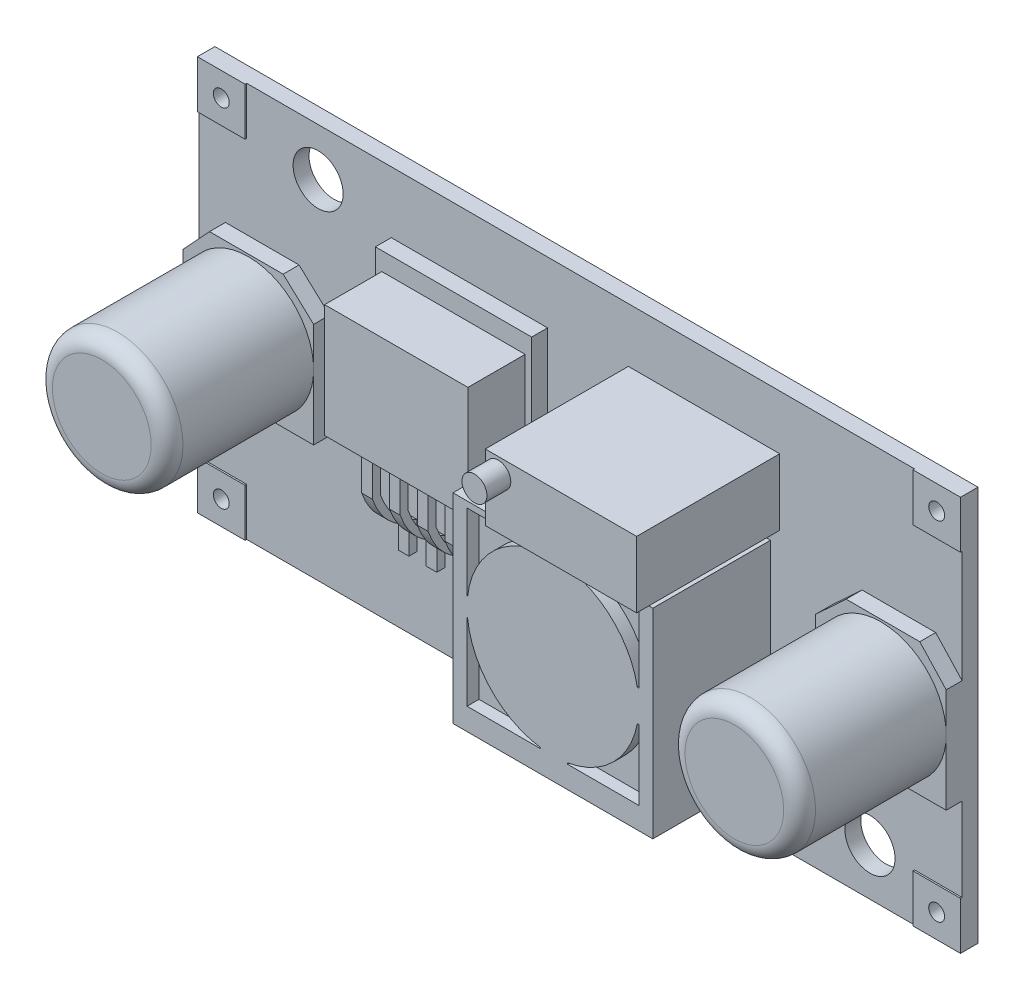
from build123d import *

# Parameters (mm, degrees)
SKETCH1_W           = 48
SKETCH1_H           = 24.85
SKETCH1_R           = 1.575
BOSS_EXTRUDE1_DEPTH = 1
SKETCH2_W           = 3
SKETCH2_H           = 3
BOSS_EXTRUDE2_DEPTH = 0.1
SKETCH3_R           = 0.5
CUT_EXTRUDE1_DEPTH  = 5
BOSS_EXTRUDE3_DEPTH = 1
SKETCH5_R           = 4.105
BOSS_EXTRUDE4_DEPTH = 9.22
FILLET1_R           = 1
FILLET2_R           = 1
SKETCH6_W           = 9.83
SKETCH6_H           = 8.75
BOSS_EXTRUDE5_DEPTH = 4.6
SKETCH7_W           = 9.83
SKETCH7_H           = 8.75
SKETCH7_W_2         = 9.014866003
SKETCH7_H_2         = 7.13033049
CUT_EXTRUDE2_DEPTH  = 3.6
SKETCH8_W           = 0.671327252
SKETCH8_H           = 3.75
BOSS_EXTRUDE6_DEPTH = 8
CUT_EXTRUDE3_DEPTH  = 9
SKETCH10_W          = 12.57
SKETCH10_H          = 12.57
BOSS_EXTRUDE7_DEPTH = 7.4
CUT_EXTRUDE7_DEPTH  = 0.75
SKETCH13_W          = 9.52
SKETCH13_H          = 4.17
BOSS_EXTRUDE8_DEPTH = 9
SKETCH14_R          = 0.785768403
BOSS_EXTRUDE9_DEPTH = 1.5


with BuildPart() as part:
    # Sketch1 → Boss-Extrude1 (new body)
    with BuildSketch(Plane.XY):
        Rectangle(SKETCH1_W, SKETCH1_H)
        with Locations((-16.506834237, 9.425)):
            Circle(SKETCH1_R, mode=Mode.SUBTRACT)
        with Locations((18.205231388, -9.425)):
            Circle(SKETCH1_R, mode=Mode.SUBTRACT)
    extrude(amount=BOSS_EXTRUDE1_DEPTH)

    # Sketch2 → Boss-Extrude2 (add)
    with BuildSketch(Plane.XY.offset(1)):
        with Locations((-22.5, 10.925)):
            Rectangle(SKETCH2_W, SKETCH2_H)
        with Locations((-22.5, -10.925)):
            Rectangle(SKETCH2_W, SKETCH2_H)
        with Locations((22.5, -10.925)):
            Rectangle(SKETCH2_W, SKETCH2_H)
        with Locations((22.5, 10.925)):
            Rectangle(SKETCH2_W, SKETCH2_H)
    extrude(amount=BOSS_EXTRUDE2_DEPTH)

    # Sketch3 → Cut-Extrude1 (cut)
    with BuildSketch(Plane.XY.offset(1.1)):
        with Locations((-22.5, 10.925)):
            Circle(SKETCH3_R)
        with Locations((-22.5, -10.925)):
            Circle(SKETCH3_R)
        with Locations((22.5, -10.925)):
            Circle(SKETCH3_R)
        with Locations((22.5, 10.925)):
            Circle(SKETCH3_R)
    extrude(amount=-CUT_EXTRUDE1_DEPTH, mode=Mode.SUBTRACT)

    # Sketch4 → Boss-Extrude3 (add)
    with BuildSketch(Plane.XY.offset(1)):
        Polygon((-17.706386609, 4.175), (-15.79, 2.397984661), (-15.79, -4.175), (-24, -4.175), (-24, 2.383236744), (-22.338544647, 4.175), align=None)
        Polygon((24, -4.175), (24, 2.383236744), (22.338544647, 4.175), (17.706386609, 4.175), (15.79, 2.397984661), (15.79, -4.175), align=None)
    extrude(amount=BOSS_EXTRUDE3_DEPTH)

    # Sketch5 → Boss-Extrude4 (add)
    with BuildSketch(Plane.XY.offset(2)):
        with Locations((-19.895, -0.07)):
            Circle(SKETCH5_R)
        with Locations(Location((19.895, -0.07, 0), (0, 0, 180))):
            Circle(SKETCH5_R)
    extrude(amount=BOSS_EXTRUDE4_DEPTH)

    # Fillet1
    fillet1_edges = [part.edges().sort_by_distance(p)[0] for p in [
        (-24, -0.07, 11.22),
    ]]
    fillet(fillet1_edges, radius=FILLET1_R)

    # Fillet2
    fillet2_edges = [part.edges().sort_by_distance(p)[0] for p in [
        (24, -0.07, 11.22),
    ]]
    fillet(fillet2_edges, radius=FILLET2_R)

    # Sketch6 → Boss-Extrude5 (add)
    with BuildSketch(Plane.XY.offset(1)):
        with Locations((-6.991368833, 4.188689514)):
            Rectangle(SKETCH6_W, SKETCH6_H)
    extrude(amount=BOSS_EXTRUDE5_DEPTH)

    # Sketch7 → Cut-Extrude2 (cut)
    with BuildSketch(Plane.XY.offset(5.6)):
        with Locations((-6.991368833, 4.188689514)):
            Rectangle(SKETCH7_W, SKETCH7_H)
        with Locations((-6.991368834, 3.853025888)):
            Rectangle(SKETCH7_W_2, SKETCH7_H_2, mode=Mode.SUBTRACT)
    extrude(amount=-CUT_EXTRUDE2_DEPTH, mode=Mode.SUBTRACT)

    # Sketch8 → Boss-Extrude6 (add)
    with BuildSketch(Plane(origin=(0, 0.287860643, 0), x_dir=(-1, 0, 0), z_dir=(0, -1, 0))):
        with Locations((8.85699558, -2.895840935)):
            Rectangle(SKETCH8_W, SKETCH8_H)
        with Locations((10.60699558, -2.895840935)):
            Rectangle(SKETCH8_W, SKETCH8_H)
        with Locations((7.10699558, -2.895840935)):
            Rectangle(SKETCH8_W, SKETCH8_H)
        with Locations((5.35699558, -2.895840935)):
            Rectangle(SKETCH8_W, SKETCH8_H)
        with Locations((3.60699558, -2.895840935)):
            Rectangle(SKETCH8_W, SKETCH8_H)
    extrude(amount=BOSS_EXTRUDE6_DEPTH)

    # Sketch9 → Cut-Extrude3 (cut)
    with BuildSketch(Plane(origin=(-3.271331954, 0, 0), x_dir=(0, 0, -1), z_dir=(1, 0, 0))):
        with BuildLine():
            Line((-3.820845945, -3.459233043), (-3.820845945, 0.287860643))
            Line((-3.820845945, 0.287860643), (-4.770840935, 0.287860643))
            Line((-4.770840935, 0.287860643), (-4.770840935, -7.712139357))
            Line((-4.770840935, -7.712139357), (-2, -7.712139357))
            Line((-2, -7.712139357), (-1.520840935, -7.712139357))
            Line((-1.520840935, -7.712139357), (-1.520840935, -5.954433266))
            add(Edge.make_bspline(
                [(-3.820845945, -3.459233043), (-3.201230597, -5.246051494), (-1.520840935, -5.954433266)],
                knots=[0, 0, 0, 1, 1, 1], degree=2))
        make_face()
        with BuildLine():
            Line((-2, 0.287860643), (-3.320845945, 0.287860643))
            Line((-3.320845945, 0.287860643), (-3.320845945, -3.459233043))
            add(Edge.make_bspline(
                [(-3.320845945, -3.459233043), (-2.701230597, -5.246051494), (-1.020840935, -5.954433266)],
                knots=[0, 0, 0, 1, 1, 1], degree=2))
            Line((-1.020840935, -5.954433266), (-1.020840935, -0.186310486))
            Line((-1.020840935, -0.186310486), (-2, -0.186310486))
            Line((-2, -0.186310486), (-2, 0.287860643))
        make_face()
    extrude(amount=-CUT_EXTRUDE3_DEPTH, mode=Mode.SUBTRACT)

    # Sketch10 → Boss-Extrude7 (add)
    with BuildSketch(Plane.XY.offset(1)):
        with Locations((5.661368833, -2.278689514)):
            Rectangle(SKETCH10_W, SKETCH10_H)
    extrude(amount=BOSS_EXTRUDE7_DEPTH)

    # Sketch11 → Cut-Extrude7 (cut)
    with BuildSketch(Plane.XY.offset(8.4)):
        with BuildLine():
            Line((0.261368833, -1.168201078), (0.29215187, -1.202921155))
            ThreePointArc((0.29215187, -1.202921155), (1.796004083, 1.992113497), (4.952819072, 3.574623221))
            Line((4.952819072, 3.574623221), (4.952819072, 3.621310486))
            Line((4.952819072, 3.621310486), (0.261368833, 3.621310486))
            Line((0.261368833, 3.621310486), (0.261368833, -1.168201078))
        make_face()
        with BuildLine():
            Line((0.261368833, -2.339421454), (0.29215187, -2.354457873))
            ThreePointArc((0.29215187, -2.354457873), (1.77039453, -5.523061153), (4.879917239, -7.121847139))
            Line((4.879917239, -7.121847139), (4.879917239, -7.178689514))
            Line((4.879917239, -7.178689514), (0.261368833, -7.178689514))
            Line((0.261368833, -7.178689514), (0.261368833, -2.339421454))
        make_face()
        with BuildLine():
            Line((11.061368833, -7.178689514), (11.061368833, -2.769135856))
            Line((11.061368833, -2.769135856), (10.969759931, -2.769135856))
            ThreePointArc((10.969759931, -2.769135856), (9.454565933, -5.622080694), (6.581950193, -7.099641493))
            Line((6.581950193, -7.099641493), (6.581950193, -7.178689514))
            Line((6.581950193, -7.178689514), (11.061368833, -7.178689514))
        make_face()
        with BuildLine():
            Line((6.280607425, 3.621310486), (6.280607425, 3.585687763))
            ThreePointArc((6.280607425, 3.585687763), (9.344711933, 2.170105696), (10.969759931, -0.788243173))
            Line((10.969759931, -0.788243173), (11.061368833, -0.788243173))
            Line((11.061368833, -0.788243173), (11.061368833, 3.621310486))
            Line((11.061368833, 3.621310486), (6.280607425, 3.621310486))
        make_face()
    extrude(amount=-CUT_EXTRUDE7_DEPTH, mode=Mode.SUBTRACT)

    # Sketch13 → Boss-Extrude8 (add)
    with BuildSketch(Plane.XY.offset(1)):
        with Locations((7.766965878, 6.922076652)):
            Rectangle(SKETCH13_W, SKETCH13_H)
    extrude(amount=BOSS_EXTRUDE8_DEPTH)

    # Sketch14 → Boss-Extrude9 (add)
    with BuildSketch(Plane.XY.offset(10)):
        with Locations((3.826540336, 8.02238566)):
            Circle(SKETCH14_R)
    extrude(amount=BOSS_EXTRUDE9_DEPTH)


solid = part.part
